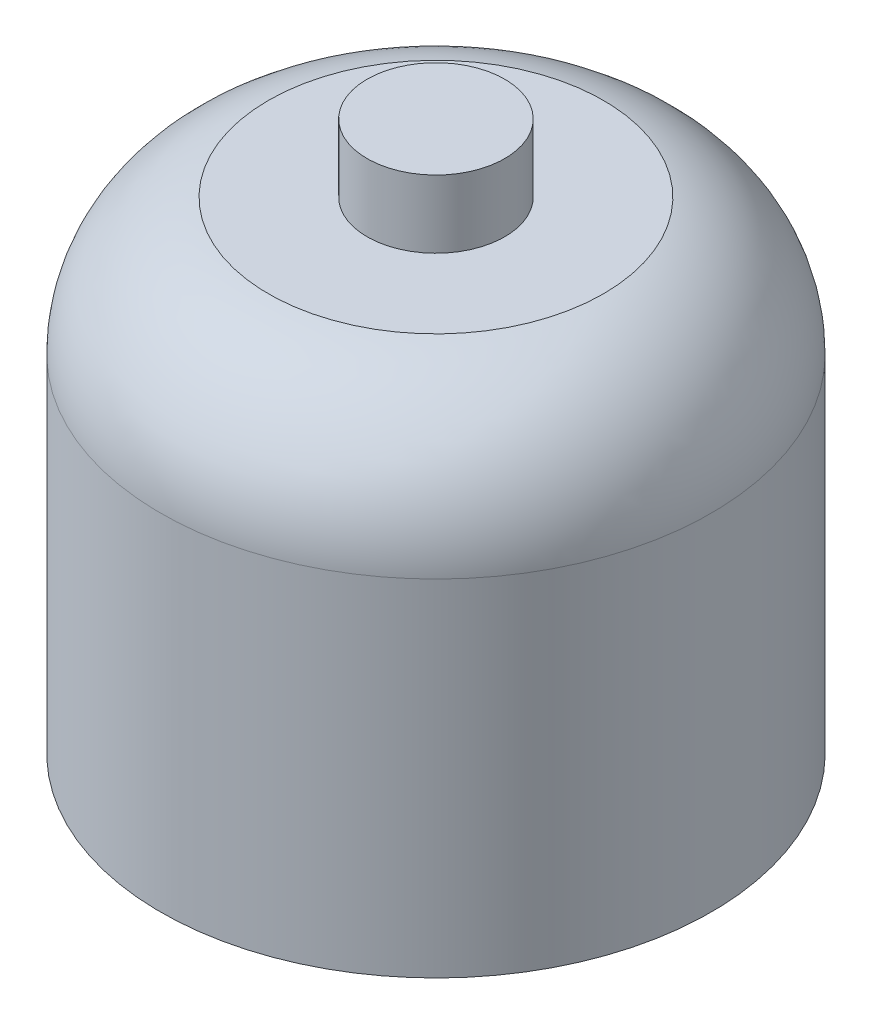
from build123d import *

# Parameters (mm, degrees)
SKETCH3_R          = 300
CUT_EXTRUDE1_DEPTH = 400


with BuildPart() as part:
    # Sketch1 → Revolve2 (revolve)
    with BuildSketch(Plane.XY):
        with BuildLine():
            Line((0, 266.536964981), (0, -433.463035019))
            Line((0, -433.463035019), (-400, -433.463035019))
            Line((-400, -433.463035019), (-400, 68.62497771))
            ThreePointArc((-400, 68.62497771), (-356.145251984, 194.783226442), (-243.492938859, 266.536964981))
            Line((-243.492938859, 266.536964981), (-100, 266.536964981))
            Line((-100, 266.536964981), (-100, 364.980544747))
            Line((-100, 364.980544747), (0, 364.980544747))
            Line((0, 364.980544747), (0, 266.536964981))
        make_face()
    revolve(axis=Axis((0, 266.536964981, 0), (0, -1, 0)))

    # Sketch3 → Cut-Extrude1 (cut)
    with BuildSketch(Plane.XZ.offset(433.463035019)):
        Circle(SKETCH3_R)
    extrude(amount=-CUT_EXTRUDE1_DEPTH, mode=Mode.SUBTRACT)


solid = part.part
